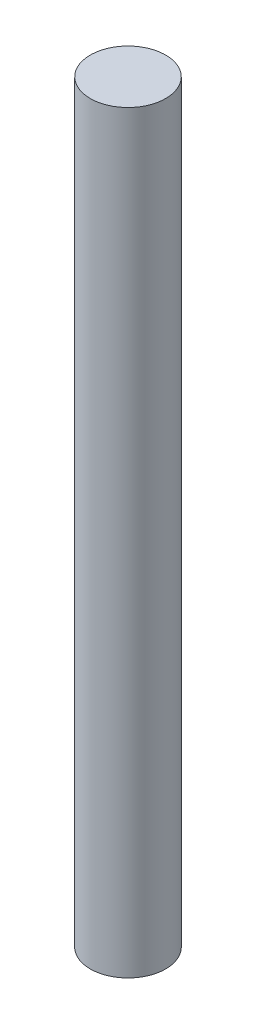
from build123d import *

# Parameters (mm, degrees)
BOSS_EXTRUDE1_DEPTH      = 10
BOSS_EXTRUDE1_DEPTH_BACK = 10
SKETCH2_R                = 1


with BuildPart() as part:
    # Sketch2 → Boss-Extrude1 (new, two sides: drawn at the far end of the back side and taken through both)
    with BuildSketch(Plane(origin=(0, 0, 0), x_dir=(1, 0, 0), z_dir=(0, 1, 0)).offset(-BOSS_EXTRUDE1_DEPTH_BACK)):
        Circle(SKETCH2_R)
    extrude(amount=BOSS_EXTRUDE1_DEPTH + BOSS_EXTRUDE1_DEPTH_BACK)


solid = part.part
